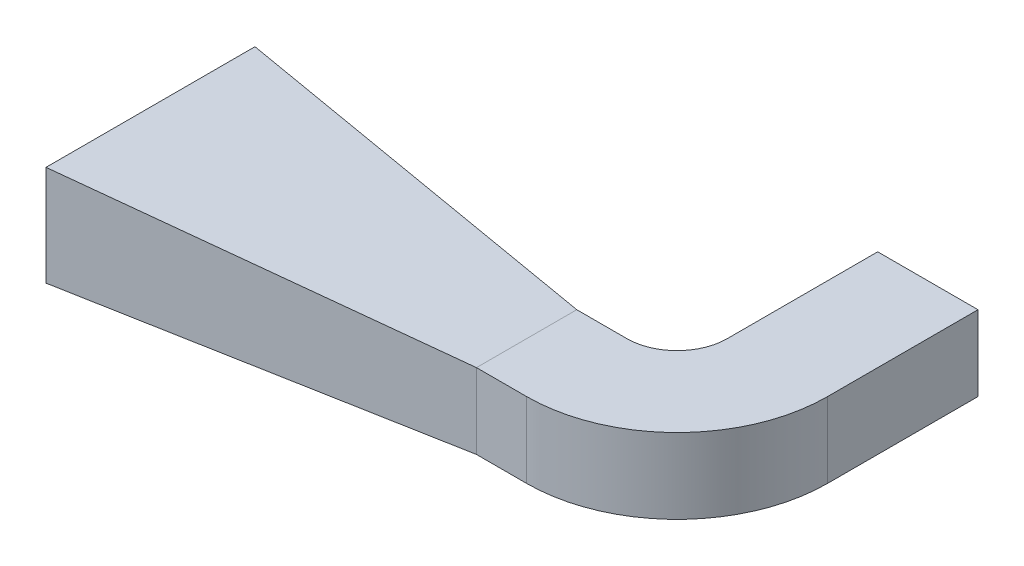
from build123d import *

# Parameters (mm, degrees)
SKETCH_2_5_W    = 240
SKETCH_2_5_H    = 180
EXTRUDE_2_DEPTH = 120
SKETCH_10_W     = 240
SKETCH_10_H     = 180
REVOLVE_2_ANGLE = 90
SKETCH_11_W     = 240
SKETCH_11_H     = 180
EXTRUDE_3_DEPTH = 360
SKETCH_13_R     = 7.5
EXTRUDE_4_DEPTH = 10


with BuildPart() as part:
    # 草图2 → 放样1 section 0
    with BuildSketch(Plane(origin=(900, 0, 0), x_dir=(0, 0, -1), z_dir=(1, 0, 0))):
        with BuildLine():
            Line((-120, 90), (120, 90))
            Line((120, 90), (120, -90))
            Line((120, -90), (-120, -90))
            Line((-120, -90), (-120, 90))
        make_face()
    # 草图1 → 放样1 section 1
    with BuildSketch(Plane(origin=(0, 0, 0), x_dir=(0, 0, -1), z_dir=(1, 0, 0))):
        with BuildLine():
            Line((-250, 120), (250, 120))
            Line((250, 120), (250, -120))
            Line((250, -120), (-250, -120))
            Line((-250, -120), (-250, 120))
        make_face()
    loft()

    # 草图2<5> → 凸台-拉伸2 (add)
    with BuildSketch(Plane(origin=(900, 0, 0), x_dir=(0, 0, -1), z_dir=(1, 0, 0))):
        Rectangle(SKETCH_2_5_W, SKETCH_2_5_H)
    extrude(amount=EXTRUDE_2_DEPTH)

    # 草图10 → 旋转2 (revolve)
    with BuildSketch(Plane(origin=(1020, 0, 0), x_dir=(0, 0, -1), z_dir=(1, 0, 0))):
        Rectangle(SKETCH_10_W, SKETCH_10_H)
    revolve(axis=Axis((1020, 90, -240), (0, 1, 0)), revolution_arc=REVOLVE_2_ANGLE)

    # 草图11 → 凸台-拉伸3 (add)
    with BuildSketch(Plane(origin=(0, 0, -240), x_dir=(-1, 0, 0), z_dir=(0, 0, -1))):
        with Locations((-1260, 0)):
            Rectangle(SKETCH_11_W, SKETCH_11_H)
    extrude(amount=EXTRUDE_3_DEPTH)

    # 草图13 → 凸台-拉伸4 (add)
    with BuildSketch(Plane.ZY):
        with Locations((225, -100)):
            Circle(SKETCH_13_R)
        with Locations((175, -100)):
            Circle(SKETCH_13_R)
        with Locations((125, -100)):
            Circle(SKETCH_13_R)
        with Locations((75, -100)):
            Circle(SKETCH_13_R)
        with Locations((25, -100)):
            Circle(SKETCH_13_R)
        with Locations((-25, -100)):
            Circle(SKETCH_13_R)
        with Locations((-75, -100)):
            Circle(SKETCH_13_R)
        with Locations((-125, -100)):
            Circle(SKETCH_13_R)
        with Locations((-175, -100)):
            Circle(SKETCH_13_R)
        with Locations((-225, -100)):
            Circle(SKETCH_13_R)
        with Locations((175, -50)):
            Circle(SKETCH_13_R)
        with Locations((125, -50)):
            Circle(SKETCH_13_R)
        with Locations((75, -50)):
            Circle(SKETCH_13_R)
        with Locations((25, -50)):
            Circle(SKETCH_13_R)
        with Locations((-25, -50)):
            Circle(SKETCH_13_R)
        with Locations((-75, -50)):
            Circle(SKETCH_13_R)
        with Locations((-125, -50)):
            Circle(SKETCH_13_R)
        with Locations((-175, -50)):
            Circle(SKETCH_13_R)
        with Locations((-225, -50)):
            Circle(SKETCH_13_R)
        with Locations((175, 0)):
            Circle(SKETCH_13_R)
        with Locations((125, 0)):
            Circle(SKETCH_13_R)
        with Locations((75, 0)):
            Circle(SKETCH_13_R)
        with Locations((25, 0)):
            Circle(SKETCH_13_R)
        with Locations((-25, 0)):
            Circle(SKETCH_13_R)
        with Locations((-75, 0)):
            Circle(SKETCH_13_R)
        with Locations((-125, 0)):
            Circle(SKETCH_13_R)
        with Locations((-175, 0)):
            Circle(SKETCH_13_R)
        with Locations((-225, 0)):
            Circle(SKETCH_13_R)
        with Locations((175, 50)):
            Circle(SKETCH_13_R)
        with Locations((125, 50)):
            Circle(SKETCH_13_R)
        with Locations((75, 50)):
            Circle(SKETCH_13_R)
        with Locations((25, 50)):
            Circle(SKETCH_13_R)
        with Locations((-25, 50)):
            Circle(SKETCH_13_R)
        with Locations((-75, 50)):
            Circle(SKETCH_13_R)
        with Locations((-125, 50)):
            Circle(SKETCH_13_R)
        with Locations((-175, 50)):
            Circle(SKETCH_13_R)
        with Locations((-225, 50)):
            Circle(SKETCH_13_R)
        with Locations((175, 100)):
            Circle(SKETCH_13_R)
        with Locations((125, 100)):
            Circle(SKETCH_13_R)
        with Locations((75, 100)):
            Circle(SKETCH_13_R)
        with Locations((25, 100)):
            Circle(SKETCH_13_R)
        with Locations((-25, 100)):
            Circle(SKETCH_13_R)
        with Locations((-75, 100)):
            Circle(SKETCH_13_R)
        with Locations((-125, 100)):
            Circle(SKETCH_13_R)
        with Locations((-175, 100)):
            Circle(SKETCH_13_R)
        with Locations((-225, 100)):
            Circle(SKETCH_13_R)
        with Locations((225, -50)):
            Circle(SKETCH_13_R)
        with Locations((225, 0)):
            Circle(SKETCH_13_R)
        with Locations((225, 50)):
            Circle(SKETCH_13_R)
        with Locations((225, 100)):
            Circle(SKETCH_13_R)
    extrude(amount=EXTRUDE_4_DEPTH)


solid = part.part
